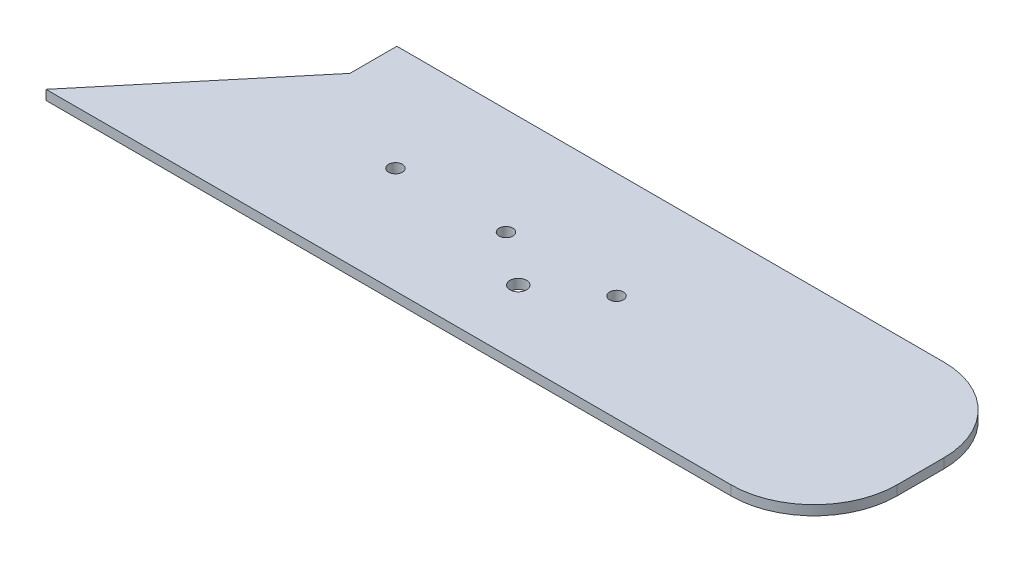
from build123d import *

# Parameters (mm, degrees)
SKETCH1_R             = 2.5
BOSS_EXTRUDE3_DEPTH   = 3.5
F_6_0MM_DOWEL_HOLE4_D = 6


with BuildPart() as part:
    # Sketch1 → Boss-Extrude3 (new body)
    with BuildSketch(Plane(origin=(0, 0, 0), x_dir=(1, 0, 0), z_dir=(0, 1, 0))):
        with BuildLine():
            Line((-18.084732229, -7.982467334), (229.915267771, -7.982467334))
            ThreePointArc((229.915267771, -7.982467334), (251.128471207, 0.80432923), (259.915267771, 22.017532666))
            Line((259.915267771, 22.017532666), (259.915267771, 39.017532666))
            ThreePointArc((259.915267771, 39.017532666), (251.128471207, 60.230736102), (229.915267771, 69.017532666))
            Line((229.915267771, 69.017532666), (31.915267771, 69.017532666))
            Line((31.915267771, 69.017532666), (31.915267771, 65.517532666))
            Line((31.915267771, 65.517532666), (31.915267771, 52.017532666))
            Line((31.915267771, 52.017532666), (-18.084732229, -7.982467334))
        make_face()
        with Locations(Location((149.915267771, 30.517532666, 0), (0, 0, 270))):
            Circle(SKETCH1_R, mode=Mode.SUBTRACT)
        with Locations(Location((109.915267771, 30.517532666, 0), (0, 0, 270))):
            Circle(SKETCH1_R, mode=Mode.SUBTRACT)
        with Locations(Location((69.915267771, 30.517532666, 0), (0, 0, 270))):
            Circle(SKETCH1_R, mode=Mode.SUBTRACT)
    extrude(amount=BOSS_EXTRUDE3_DEPTH)

    # Ø6.0mm Dowel Hole4 (through all)
    with Locations(Plane(origin=(224.539982251, 261.5, -21.544477375), x_dir=(1, 0, 0), z_dir=(0, 1, 0))):
        with Locations((-95.797211751, -5.414641336)):
            Hole(F_6_0MM_DOWEL_HOLE4_D / 2)


solid = part.part
